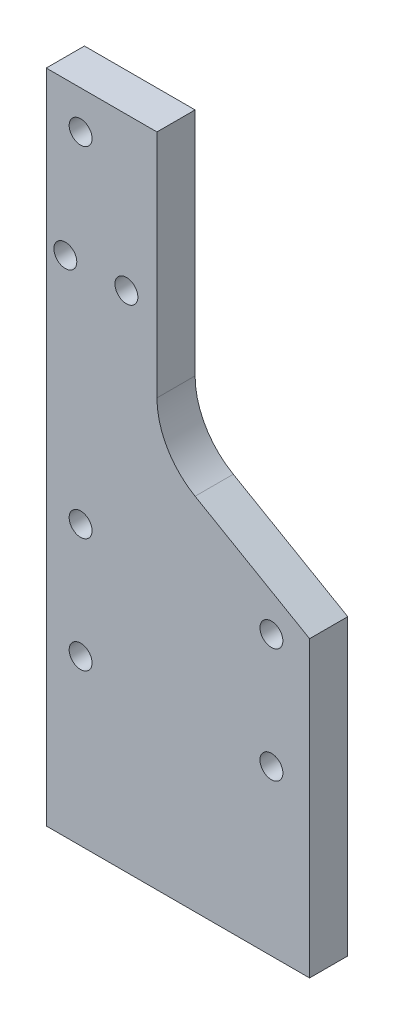
from build123d import *

# Parameters (mm, degrees)
SKETCH_1_R          = 3
EXTRUDE_1_DEPTH     = 10
SKETCH_4_W          = 69
SKETCH_4_H          = 17
CUT_EXTRUDE_2_DEPTH = 202.449745594


with BuildPart() as part:
    # Эскиз1 → Бобышка-Вытянуть1 (new body)
    with BuildSketch(Plane.XY):
        with BuildLine():
            Line((0, 0), (-69, 0))
            Line((-69, 0), (-69, 189))
            Line((-69, 189), (-40, 189))
            Line((-40, 189), (-40, 128.641016151))
            ThreePointArc((-40, 128.641016151), (-37.320508076, 118.641016151), (-30, 111.320508076))
            Line((-30, 111.320508076), (0, 94))
            Line((0, 94), (0, 0))
        make_face()
        with Locations((-10, 10)):
            Circle(SKETCH_1_R, mode=Mode.SUBTRACT)
        with Locations((-60, 10)):
            Circle(SKETCH_1_R, mode=Mode.SUBTRACT)
        with Locations((-60, 60)):
            Circle(SKETCH_1_R, mode=Mode.SUBTRACT)
        with Locations((-10, 60)):
            Circle(SKETCH_1_R, mode=Mode.SUBTRACT)
        with Locations((-60, 90)):
            Circle(SKETCH_1_R, mode=Mode.SUBTRACT)
        with Locations((-10, 90)):
            Circle(SKETCH_1_R, mode=Mode.SUBTRACT)
        with Locations((-64, 149)):
            Circle(SKETCH_1_R, mode=Mode.SUBTRACT)
        with Locations((-48, 149)):
            Circle(SKETCH_1_R, mode=Mode.SUBTRACT)
        with Locations((-60, 179)):
            Circle(SKETCH_1_R, mode=Mode.SUBTRACT)
    extrude(amount=EXTRUDE_1_DEPTH)

    # Эскиз4 → Вырез-Вытянуть2 (cut, through all)
    with BuildSketch(Plane.XY.offset(10)):
        with Locations((-34.5, 8.5)):
            Rectangle(SKETCH_4_W, SKETCH_4_H)
    extrude(amount=-CUT_EXTRUDE_2_DEPTH, mode=Mode.SUBTRACT)


solid = part.part
